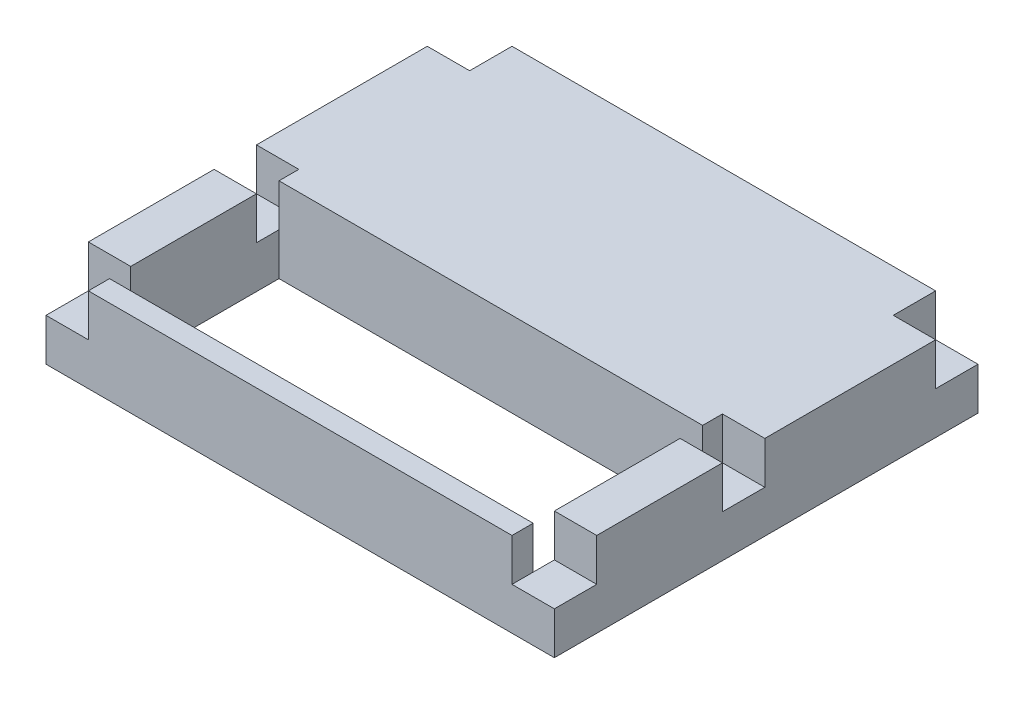
from build123d import *

# Parameters (mm, degrees)
SKETCH1_W           = 120
SKETCH1_H           = 100
BOSS_EXTRUDE1_DEPTH = 20
SKETCH6_W           = 110
SKETCH6_H           = 40
CUT_EXTRUDE1_DEPTH  = 20
SKETCH6_3_W         = 5
SKETCH6_3_H         = 40
BOSS_EXTRUDE4_DEPTH = 20
SKETCH14_W          = 10
SKETCH14_H          = 10
CUT_EXTRUDE2_DEPTH  = 10
SKETCH15_W          = 10
SKETCH15_H          = 10
CUT_EXTRUDE3_DEPTH  = 10
SKETCH16_W          = 3
SKETCH16_H          = 3
SKETCH16_W_2        = 6
SKETCH16_H_2        = 6
CUT_EXTRUDE4_DEPTH  = 5


with BuildPart() as part:
    # Sketch1 → Boss-Extrude1 (new body)
    with BuildSketch(Plane(origin=(0, 0, 0), x_dir=(1, 0, 0), z_dir=(0, 1, 0))):
        Rectangle(SKETCH1_W, SKETCH1_H)
    extrude(amount=BOSS_EXTRUDE1_DEPTH)

    # Sketch6 → Cut-Extrude1 (cut)
    with BuildSketch(Plane.XZ):
        with Locations((0, 25)):
            Rectangle(SKETCH6_W, SKETCH6_H)
    extrude(amount=-CUT_EXTRUDE1_DEPTH, mode=Mode.SUBTRACT)

    # Sketch6<3> → Boss-Extrude4 (add)
    with BuildSketch(Plane.XZ):
        with Locations((-52.5, 25)):
            Rectangle(SKETCH6_3_W, SKETCH6_3_H)
        with Locations((52.5, 25)):
            Rectangle(SKETCH6_3_W, SKETCH6_3_H)
    extrude(amount=-BOSS_EXTRUDE4_DEPTH)

    # Sketch14 → Cut-Extrude2 (cut)
    with BuildSketch(Plane(origin=(0, 20, 0), x_dir=(1, 0, 0), z_dir=(0, 1, 0))):
        with Locations((55, -5.320888862)):
            Rectangle(SKETCH14_W, SKETCH14_H)
        with Locations((-55, -5.320888862)):
            Rectangle(SKETCH14_W, SKETCH14_H)
    extrude(amount=-CUT_EXTRUDE2_DEPTH, mode=Mode.SUBTRACT)

    # Sketch15 → Cut-Extrude3 (cut)
    with BuildSketch(Plane(origin=(0, 20, 0), x_dir=(1, 0, 0), z_dir=(0, 1, 0))):
        with Locations((-55, 45)):
            Rectangle(SKETCH15_W, SKETCH15_H)
        with Locations((55, 45)):
            Rectangle(SKETCH15_W, SKETCH15_H)
        with Locations((55, -45)):
            Rectangle(SKETCH15_W, SKETCH15_H)
        with Locations((-55, -45)):
            Rectangle(SKETCH15_W, SKETCH15_H)
    extrude(amount=-CUT_EXTRUDE3_DEPTH, mode=Mode.SUBTRACT)

    # Sketch16 → Cut-Extrude4 (cut)
    with BuildSketch(Plane.XZ):
        with Locations((-57.5, 47.5)):
            Rectangle(SKETCH16_W, SKETCH16_H)
        with Locations((-57.5, 2.5)):
            Rectangle(SKETCH16_W, SKETCH16_H)
        with Locations((57.5, 2.5)):
            Rectangle(SKETCH16_W, SKETCH16_H)
        with Locations((57.5, 47.5)):
            Rectangle(SKETCH16_W, SKETCH16_H)
        with Locations((55, -25)):
            Rectangle(SKETCH16_W_2, SKETCH16_H_2)
        with Locations((-55, -25)):
            Rectangle(SKETCH16_W_2, SKETCH16_H_2)
    extrude(amount=-CUT_EXTRUDE4_DEPTH, mode=Mode.SUBTRACT)


solid = part.part
